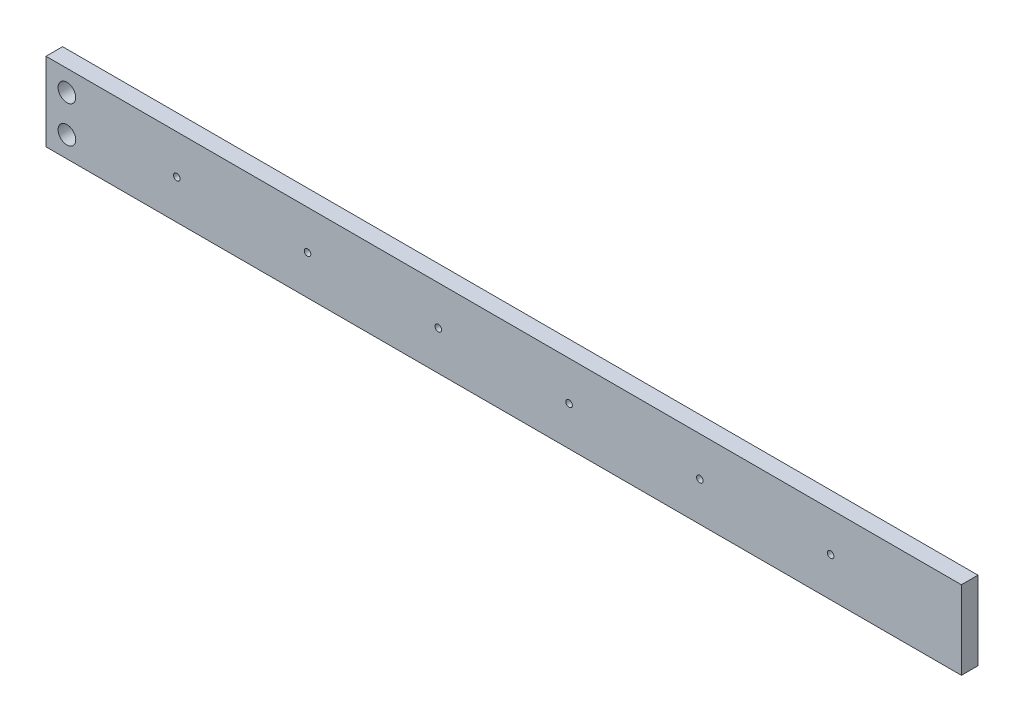
from build123d import *

# Parameters (mm, degrees)
SKETCH2_W                   = 350
SKETCH2_H                   = 30
BOSS_EXTRUDE1_DEPTH         = 6.35
F_1_4_CLEARANCE_HOLE1_D     = 6.7564
TAP_DRILL_FOR_M3X0_5_TAP1_D = 2.5
LPATTERN1_COUNT             = 6
LPATTERN1_PITCH             = 50


with BuildPart() as part:
    # Sketch2 → Boss-Extrude1 (new body)
    with BuildSketch(Plane.XY):
        with Locations((175, 15)):
            Rectangle(SKETCH2_W, SKETCH2_H)
    extrude(amount=BOSS_EXTRUDE1_DEPTH)

    # 1/4 Clearance Hole1 (through all)
    with Locations(Plane.XY.offset(6.35)):
        with Locations((8, 22), (8, 8)):
            Hole(F_1_4_CLEARANCE_HOLE1_D / 2)

    # Tap Drill for M3x0.5 Tap1 (through all)
    with Locations(Plane.XY.offset(6.35)):
        with Locations((50, 15)):
            tap_drill_for_m3x0_5_tap1 = Hole(TAP_DRILL_FOR_M3X0_5_TAP1_D / 2)

    # LPattern1: Tap Drill for M3x0.5 Tap1 ×6
    with Locations(*[(i * LPATTERN1_PITCH, 0, 0) for i in range(1, LPATTERN1_COUNT)]):
        add(tap_drill_for_m3x0_5_tap1, mode=Mode.SUBTRACT)


solid = part.part
